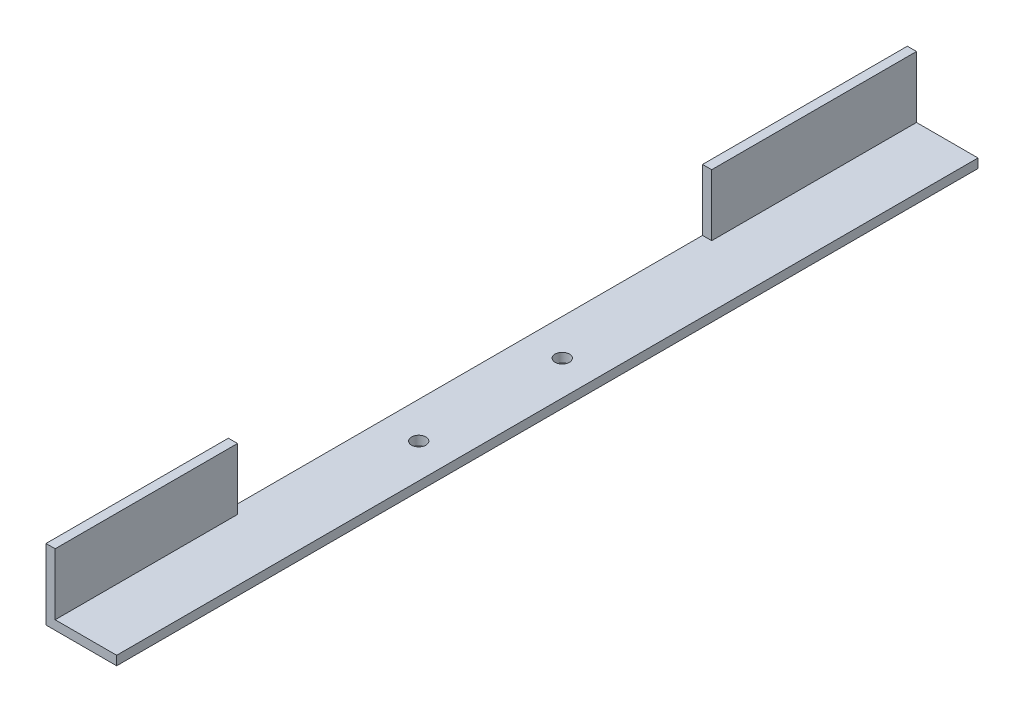
from build123d import *

# Parameters (mm, degrees)
EXTRUDE_1_DEPTH     = 304.8
SKETCH_2_W          = 167.801792078
SKETCH_2_H          = 21.76
CUT_EXTRUDE_1_DEPTH = 304.8
SKETCH_4_R          = 2.54
CUT_EXTRUDE_2_DEPTH = 304.8


with BuildPart() as part:
    # 草图1 → 凸台-拉伸1 (new body)
    with BuildSketch(Plane.XY):
        Polygon((0, 0), (0, 25), (3.24, 25), (3.24, 3.24), (25, 3.24), (25, 0), align=None)
    extrude(amount=EXTRUDE_1_DEPTH)

    # 草图2 → 切除-拉伸1 (cut)
    with BuildSketch(Plane(origin=(3.24, 0, 0), x_dir=(0, 0, -1), z_dir=(1, 0, 0))):
        with Locations((-156.372580305, 14.12)):
            Rectangle(SKETCH_2_W, SKETCH_2_H)
    extrude(amount=-CUT_EXTRUDE_1_DEPTH, mode=Mode.SUBTRACT)

    # 草图4 → 切除-拉伸2 (cut)
    with BuildSketch(Plane(origin=(0, 3.24, 0), x_dir=(1, 0, 0), z_dir=(0, 1, 0))):
        with Locations(Location((12.797495231, -134.915130156, 0), (0, 0, 270))):
            Circle(SKETCH_4_R)
        with Locations(Location((12.803446161, -185.715129807, 0), (0, 0, 270))):
            Circle(SKETCH_4_R)
    extrude(amount=-CUT_EXTRUDE_2_DEPTH, mode=Mode.SUBTRACT)


solid = part.part
